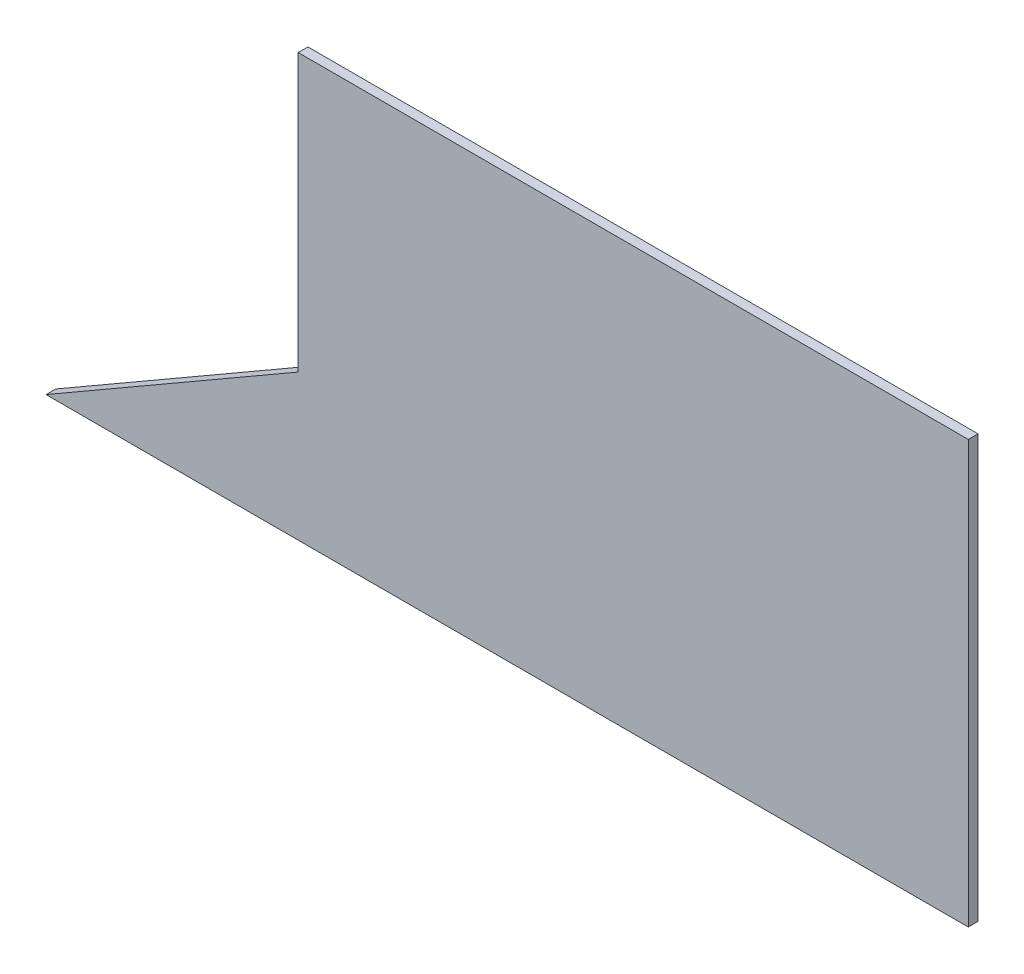
from build123d import *

# Parameters (mm, degrees)
BOSS_EXTRUDE1_DEPTH = 2


with BuildPart() as part:
    # Sketch1 → Boss-Extrude1 (new body)
    with BuildSketch(Plane.XY):
        Polygon((-82.642857143, -41.630952381), (107.357142857, -41.630952381), (107.357142857, 45.369047619), (-30.681332916, 45.369047619), (-30.681332916, -11.630952381), align=None)
    extrude(amount=BOSS_EXTRUDE1_DEPTH)


solid = part.part
